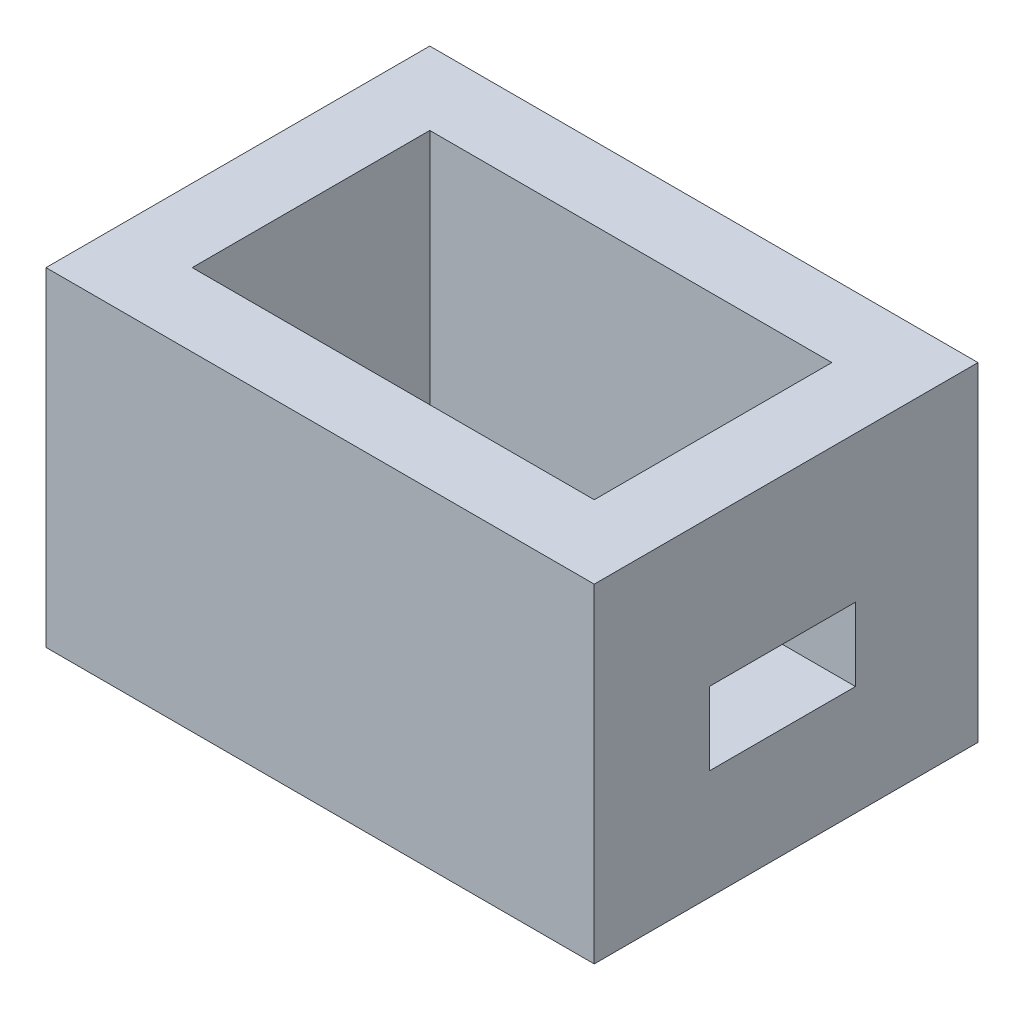
from build123d import *

# Parameters (mm, degrees)
SKETCH2_W           = 30
SKETCH2_H           = 21
BOSS_EXTRUDE3_DEPTH = 18
SHELL5_T            = -4
SKETCH3_W           = 8
SKETCH3_H           = 4
CUT_EXTRUDE2_DEPTH  = 21.4


with BuildPart() as part:
    # Sketch2 → Boss-Extrude3 (new body)
    with BuildSketch(Plane(origin=(0, 0, 0), x_dir=(1, 0, 0), z_dir=(0, 1, 0))):
        Rectangle(SKETCH2_W, SKETCH2_H)
    extrude(amount=BOSS_EXTRUDE3_DEPTH)

    # Shell5
    shell5_openings = [part.faces().sort_by_distance(p)[0] for p in [
        (0, 18, 0),
    ]]
    offset(amount=SHELL5_T, openings=shell5_openings, kind=Kind.INTERSECTION)

    # Sketch3 → Cut-Extrude2 (cut)
    with BuildSketch(Plane(origin=(15, 0, 0), x_dir=(0, 0, -1), z_dir=(1, 0, 0))):
        with Locations((-0.205398777, 8)):
            Rectangle(SKETCH3_W, SKETCH3_H)
    extrude(amount=-CUT_EXTRUDE2_DEPTH, mode=Mode.SUBTRACT)


solid = part.part
